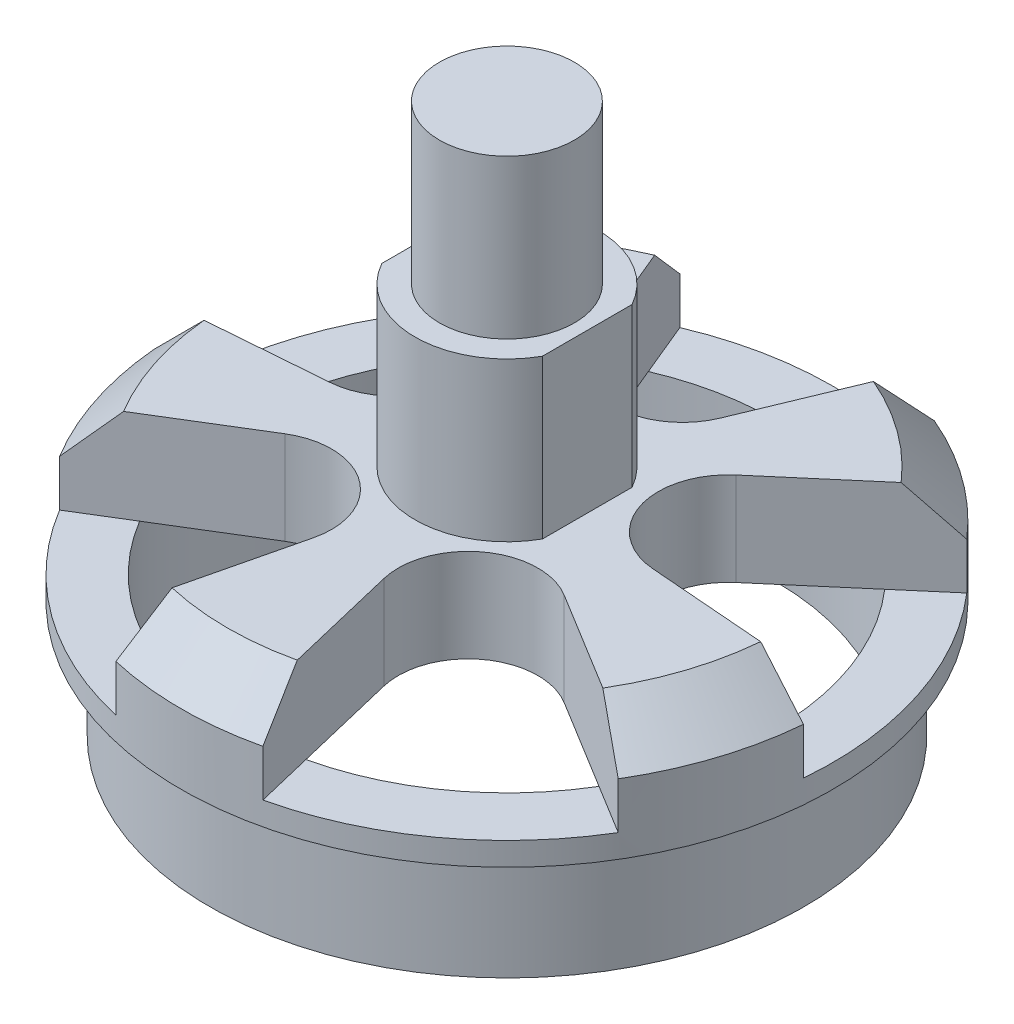
from build123d import *

# Parameters (mm, degrees)
SKETCH_1_R          = 14
EXTRUDE_1_DEPTH     = 10
SKETCH_2_R          = 11.5
CUT_EXTRUDE_1_DEPTH = 6
SKETCH_3_R          = 14
SKETCH_3_R_2        = 12.75
CUT_EXTRUDE_2_DEPTH = 5
CUT_EXTRUDE_START   = -4
CUT_EXTRUDE_3_DEPTH = 4
CHAMFER_1_SIZE      = 2
EXTRUDE_2_DEPTH     = 6.8
SKETCH_6_R          = 2.9
EXTRUDE_3_DEPTH     = 6.8
SKETCH_7_R          = 1.5
CUT_EXTRUDE_4_DEPTH = 5


with BuildPart() as part:
    # 草图1 → 凸台-拉伸1 (new body)
    with BuildSketch(Plane(origin=(0, 0, 0), x_dir=(1, 0, 0), z_dir=(0, 1, 0))):
        with Locations(Location((0, 0, 0), (0, 0, 270))):
            Circle(SKETCH_1_R)
    extrude(amount=EXTRUDE_1_DEPTH)

    # 草图2 → 切除-拉伸1 (cut)
    with BuildSketch(Plane.XZ):
        with Locations(Location((0, 0, 0), (0, 0, 270))):
            Circle(SKETCH_2_R)
    extrude(amount=-CUT_EXTRUDE_1_DEPTH, mode=Mode.SUBTRACT)

    # 草图3 → 切除-拉伸2 (cut)
    with BuildSketch(Plane.XZ):
        with Locations(Location((0, 0, 0), (0, 0, 270))):
            Circle(SKETCH_3_R)
        with Locations(Location((0, 0, 0), (0, 0, 270))):
            Circle(SKETCH_3_R_2, mode=Mode.SUBTRACT)
    extrude(amount=-CUT_EXTRUDE_2_DEPTH, mode=Mode.SUBTRACT)

    # 草图4 → 切除-拉伸3 (cut)
    with BuildSketch(Plane(origin=(0, 10, 0), x_dir=(1, 0, 0), z_dir=(0, 1, 0)).offset(CUT_EXTRUDE_START)):
        with BuildLine():
            Line((-5.46333165, 12.889996403), (-2.771638598, 6.39167453))
            ThreePointArc((-2.771638598, 6.39167453), (0, 4.539724827), (2.771638598, 6.39167453))
            Line((2.771638598, 6.39167453), (5.46333165, 12.889996403))
            ThreePointArc((5.46333165, 12.889996403), (0, 14), (-5.46333165, 12.889996403))
        make_face()
        with BuildLine():
            Line((-5.222360283, 4.611121001), (-10.570852749, 9.179165113))
            ThreePointArc((-10.570852749, 9.179165113), (-13.114723376, 4.899390856), (-14, 0))
            ThreePointArc((-14, 0), (-13.986838163, -0.6069252), (-13.9473774, -1.212709221))
            Line((-13.9473774, -1.212709221), (-6.935327141, -0.660848897))
            ThreePointArc((-6.935327141, -0.660848897), (-4.317534879, 1.402852121), (-5.222360283, 4.611121001))
        make_face()
        with BuildLine():
            Line((-5.999234754, -3.541845025), (-11.996477939, -7.216960375))
            ThreePointArc((-11.996477939, -7.216960375), (-8.228993532, -11.326237921), (-3.156621637, -13.63949192))
            Line((-3.156621637, -13.63949192), (-1.514629298, -6.800101609))
            ThreePointArc((-1.514629298, -6.800101609), (-2.668383303, -3.672714535), (-5.999234754, -3.541845025))
        make_face()
        with BuildLine():
            ThreePointArc((3.156621637, -13.63949192), (8.228993532, -11.326237921), (11.996477939, -7.216960375))
            Line((11.996477939, -7.216960375), (5.999234754, -3.541845025))
            ThreePointArc((5.999234754, -3.541845025), (2.668383303, -3.672714535), (1.514629298, -6.800101609))
            Line((1.514629298, -6.800101609), (3.156621637, -13.63949192))
        make_face()
        with BuildLine():
            ThreePointArc((14, 0), (13.114723376, 4.899390856), (10.570852749, 9.179165113))
            Line((10.570852749, 9.179165113), (5.222360283, 4.611121001))
            ThreePointArc((5.222360283, 4.611121001), (4.317534879, 1.402852121), (6.935327141, -0.660848897))
            Line((6.935327141, -0.660848897), (13.9473774, -1.212709221))
            ThreePointArc((13.9473774, -1.212709221), (13.986838163, -0.6069252), (14, 0))
        make_face()
    extrude(amount=CUT_EXTRUDE_3_DEPTH, mode=Mode.SUBTRACT)

    # 倒角1
    chamfer_1_edges = [part.edges().sort_by_distance(p)[0] for p in [
        (-8.228993532, 10, -11.326237921),
        (-13.314791228, 10, 4.326237921),
        (1.588570602, 10, 13.909580994),
        (13.314791228, 10, 4.326237921),
        (8.228993532, 10, -11.326237921),
    ]]
    chamfer(chamfer_1_edges, length=CHAMFER_1_SIZE)

    # 草图5 → 凸台-拉伸2 (add)
    with BuildSketch(Plane(origin=(0, 10, 0), x_dir=(1, 0, 0), z_dir=(0, 1, 0))):
        with BuildLine():
            Line((-3.45, 1.923538406), (-3.45, -1.923538406))
            ThreePointArc((-3.45, -1.923538406), (0, -3.95), (3.45, -1.923538406))
            Line((3.45, -1.923538406), (3.45, 1.923538406))
            ThreePointArc((3.45, 1.923538406), (0, 3.95), (-3.45, 1.923538406))
        make_face()
    extrude(amount=EXTRUDE_2_DEPTH)

    # 草图6 → 凸台-拉伸3 (add)
    with BuildSketch(Plane(origin=(0, 16.8, 0), x_dir=(1, 0, 0), z_dir=(0, 1, 0))):
        with Locations(Location((0, 0, 0), (0, 0, 270))):
            Circle(SKETCH_6_R)
    extrude(amount=EXTRUDE_3_DEPTH)

    # 草图7 → 切除-拉伸4 (cut)
    with BuildSketch(Plane.XZ.offset(-6)):
        with Locations(Location((0, 0, 0), (0, 0, 270))):
            Circle(SKETCH_7_R)
    extrude(amount=-CUT_EXTRUDE_4_DEPTH, mode=Mode.SUBTRACT)


solid = part.part
